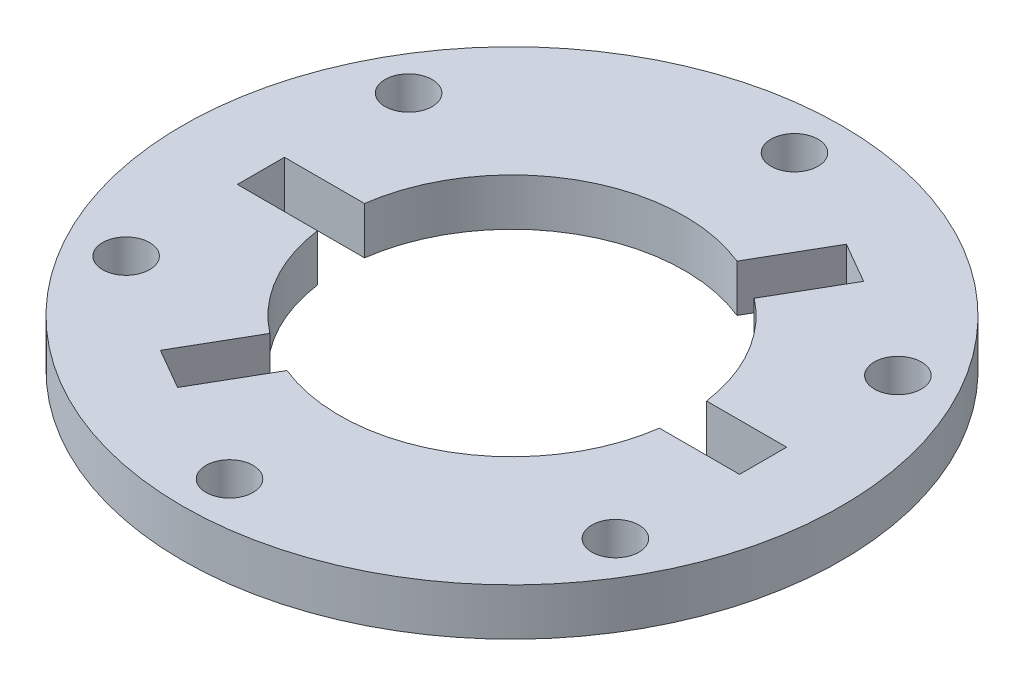
from build123d import *

# Parameters (mm, degrees)
SKETCH1_R           = 21
SKETCH1_R_2         = 1.5
BOSS_EXTRUDE2_DEPTH = 3


with BuildPart() as part:
    # Sketch1 → Boss-Extrude2 (new body)
    with BuildSketch(Plane(origin=(0, 0, 0), x_dir=(1, 0, 0), z_dir=(0, 1, 0))):
        with Locations(Location((0, 0, 0), (0, 0, 270))):
            Circle(SKETCH1_R)
        with Locations(Location((-15.588457268, 9, 0), (0, 0, 270))):
            Circle(SKETCH1_R_2, mode=Mode.SUBTRACT)
        with Locations(Location((-15.588457268, -9, 0), (0, 0, 270))):
            Circle(SKETCH1_R_2, mode=Mode.SUBTRACT)
        with Locations(Location((0, -18, 0), (0, 0, 270))):
            Circle(SKETCH1_R_2, mode=Mode.SUBTRACT)
        with Locations(Location((15.588457268, -9, 0), (0, 0, 270))):
            Circle(SKETCH1_R_2, mode=Mode.SUBTRACT)
        with Locations(Location((15.588457268, 9, 0), (0, 0, 270))):
            Circle(SKETCH1_R_2, mode=Mode.SUBTRACT)
        with Locations(Location((0, 18, 0), (0, 0, 270))):
            Circle(SKETCH1_R_2, mode=Mode.SUBTRACT)
        with BuildLine():
            ThreePointArc((4.149585574, 10.187293044), (-5.5, 9.526279442), (-10.897247359, 1.5))
            Line((-10.897247359, 1.5), (-16, 1.5))
            Line((-16, 1.5), (-16, -1.5))
            Line((-16, -1.5), (-10.897247359, -1.5))
            ThreePointArc((-10.897247359, -1.5), (-9.526279442, -5.5), (-6.747661785, -8.687293044))
            Line((-6.747661785, -8.687293044), (-9.299038106, -13.106406461))
            Line((-9.299038106, -13.106406461), (-6.700961894, -14.606406461))
            Line((-6.700961894, -14.606406461), (-4.149585574, -10.187293044))
            ThreePointArc((-4.149585574, -10.187293044), (5.5, -9.526279442), (10.897247359, -1.5))
            Line((10.897247359, -1.5), (16, -1.5))
            Line((16, -1.5), (16, 1.5))
            Line((16, 1.5), (10.897247359, 1.5))
            ThreePointArc((10.897247359, 1.5), (9.526279442, 5.5), (6.747661785, 8.687293044))
            Line((6.747661785, 8.687293044), (9.299038106, 13.106406461))
            Line((9.299038106, 13.106406461), (6.700961894, 14.606406461))
            Line((6.700961894, 14.606406461), (4.149585574, 10.187293044))
        make_face(mode=Mode.SUBTRACT)
    extrude(amount=BOSS_EXTRUDE2_DEPTH)


solid = part.part
